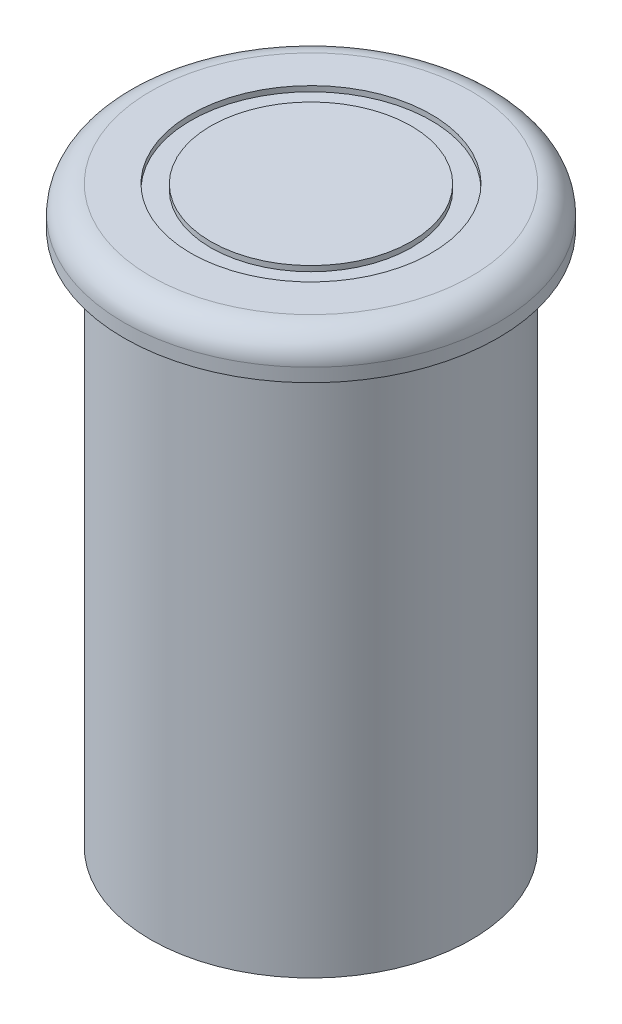
from build123d import *

# Parameters (mm, degrees)
FILLET_1_R          = 1
SKETCH_2_R          = 4.5
SKETCH_2_R_2        = 3.75
CUT_EXTRUDE_1_DEPTH = 0.2


with BuildPart() as part:
    # 草图1 → 旋转1 (revolve)
    with BuildSketch(Plane.XY, mode=Mode.PRIVATE) as revolve_1_sk:
        Polygon((0, 0), (7, 0), (7, -1.5), (6, -1.5), (6, -21.5), (0, -21.5), align=None)
    revolve(revolve_1_sk.sketch.rotate(Axis((0, 0, 0), (0, 1, 0)), 90), axis=Axis((0, 0, 0), (0, 1, 0)))

    # 圆角1
    fillet_1_edges = [part.edges().sort_by_distance(p)[0] for p in [
        (0, 0, 7),
    ]]
    fillet(fillet_1_edges, radius=FILLET_1_R)

    # 草图2 → 切除-拉伸1 (cut)
    with BuildSketch(Plane(origin=(0, 0, 0), x_dir=(1, 0, 0), z_dir=(0, 1, 0))):
        with Locations(Location((0, 0, 0), (0, 0, 270))):
            Circle(SKETCH_2_R)
        with Locations(Location((0, 0, 0), (0, 0, 270))):
            Circle(SKETCH_2_R_2, mode=Mode.SUBTRACT)
    extrude(amount=-CUT_EXTRUDE_1_DEPTH, mode=Mode.SUBTRACT)


solid = part.part
